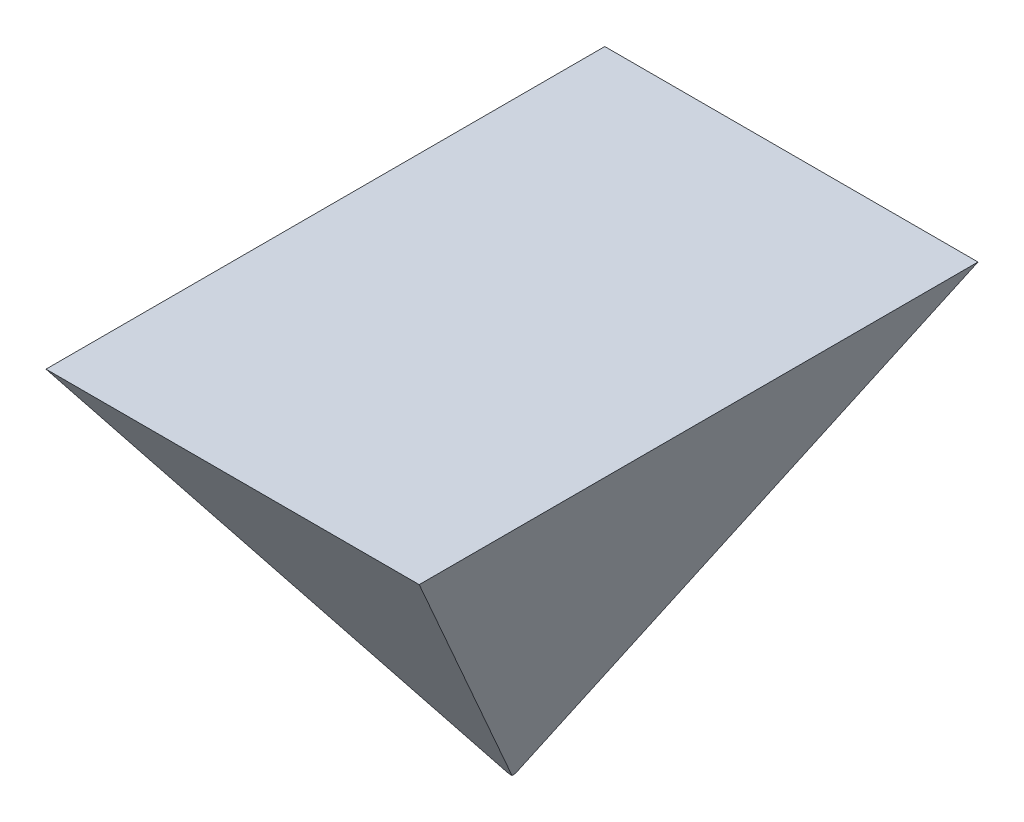
from build123d import *

# Parameters (mm, degrees)
SKETCH1_W               = 5
SKETCH1_H               = 5
BOSS_EXTRUDE1_DEPTH     = 600
BOSS_EXTRUDE1_TAPER     = -35
CUT_EXTRUDE1_DEPTH      = 847.890178858
CUT_EXTRUDE1_DEPTH_BACK = 847.890178858


with BuildPart() as part:
    # Sketch1 → Boss-Extrude1 (new body)
    with BuildSketch(Plane(origin=(0, 0, 0), x_dir=(1, 0, 0), z_dir=(0, 1, 0))):
        Rectangle(SKETCH1_W, SKETCH1_H)
    extrude(amount=BOSS_EXTRUDE1_DEPTH, taper=BOSS_EXTRUDE1_TAPER)

    # Sketch3 → Cut-Extrude1 (cut, two sides: drawn at the far end of the back side and taken through both)
    with BuildSketch(Plane.XY.offset(-CUT_EXTRUDE1_DEPTH_BACK)):
        Polygon((-422.624522926, 600), (-282.284594893, 600), (-2.5, 0), align=None)
        Polygon((422.624522926, 600), (2.5, 0), (282.284594893, 600), align=None)
    extrude(amount=CUT_EXTRUDE1_DEPTH + CUT_EXTRUDE1_DEPTH_BACK, mode=Mode.SUBTRACT)


solid = part.part
